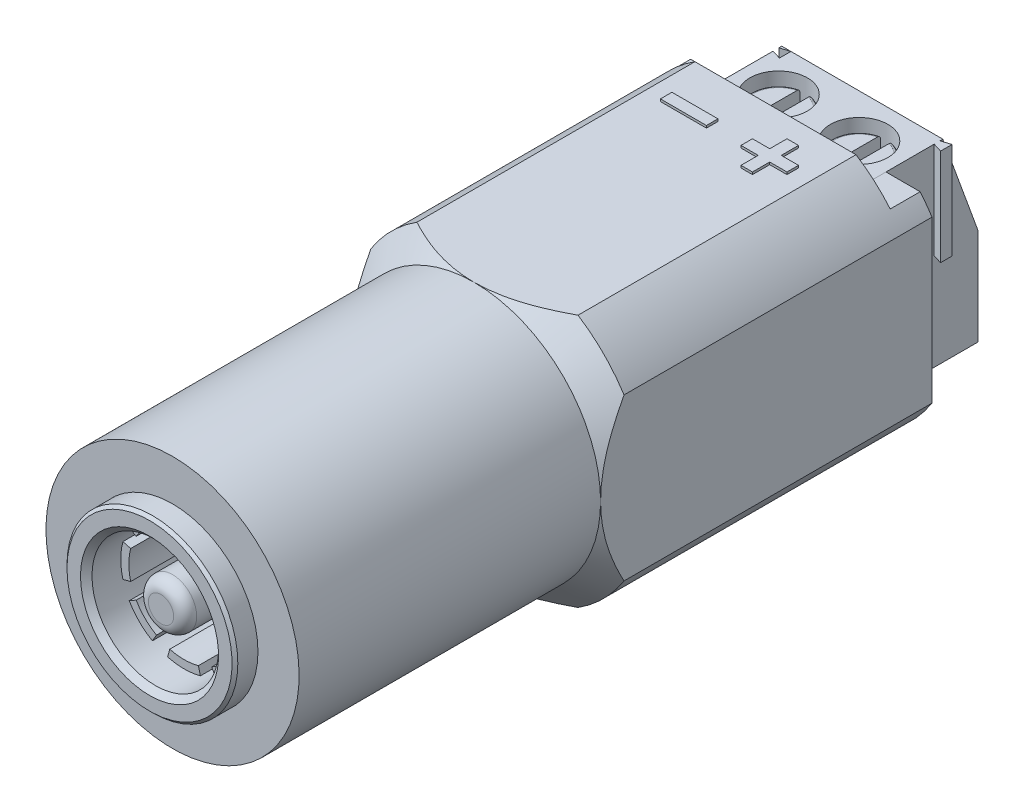
from build123d import *

# Parameters (mm, degrees)
BOSS_EXTRUDE3_DEPTH     = 13.1
SKETCH16_OUTSIDE_W      = 51.564
SKETCH16_OUTSIDE_H      = 51.564
SKETCH16_OUTSIDE_R      = 5.5
CUT_EXTRUDE2_DEPTH      = 16.235156711
CUT_EXTRUDE2_DRAFT      = -45
BOSS_EXTRUDE4_START     = 1.3
BOSS_EXTRUDE4_DEPTH     = 1.3
SKETCH17_W              = 7
SKETCH17_H              = 8.4
BOSS_EXTRUDE5_DEPTH     = 5.3
CUT_EXTRUDE3_DEPTH      = 19.015618285
CUT_EXTRUDE3_DEPTH_BACK = 19.015618285
BOSS_EXTRUDE6_DEPTH     = 4.2
CUT_EXTRUDE4_DEPTH      = 19.015618285
SKETCH22_W              = 2.375
SKETCH22_H              = 3.45
CUT_EXTRUDE5_DEPTH      = 5.3
CUT_EXTRUDE6_REACH      = 21.708
SKETCH23_R              = 1.25
SKETCH30_R              = 3.7125
CUT_EXTRUDE8_DEPTH      = 4
SKETCH6_W               = 5
SKETCH6_H               = 0.9625
CHAMFER5_SIZE           = 0.25
CHAMFER6_SIZE           = 0.125
SKETCH25_R              = 1.2
BOSS_EXTRUDE7_DEPTH     = 3.7
BOSS_EXTRUDE7_2_DEPTH   = 3.7
SKETCH26_W              = 0.5
SKETCH26_H              = 6.828674984
CUT_EXTRUDE7_DEPTH      = 1
FILLET12_R              = 0.125
FILLET13_R              = 0.125
BOSS_EXTRUDE8_DEPTH     = 5.3
BOSS_EXTRUDE8_2_DEPTH   = 5.3
SKETCH28_W              = 1
SKETCH28_H              = 0.488334262
BOSS_EXTRUDE9_DEPTH     = 2
BOSS_EXTRUDE9_2_DEPTH   = 2
FILLET14_R              = 0.2
FILLET15_R              = 0.2
SKETCH31_R              = 1.05
BOSS_EXTRUDE11_DEPTH    = 4.5
BOSS_EXTRUDE12_START    = -1
BOSS_EXTRUDE12_DEPTH    = 3.5
FILLET17_R              = 0.5
SKETCH29_W              = 2
SKETCH29_H              = 0.5
BOSS_EXTRUDE10_DEPTH    = 0.1


with BuildPart() as part:
    # Sketch2 → Revolve1 (revolve)
    with BuildSketch(Plane(origin=(0, 0, 0), x_dir=(0, 0, -1), z_dir=(1, 0, 0))):
        Polygon((-15.25, 5.5), (10.95, 5.5), (10.95, 0), (0, 0), (-15.25, 0), align=None)
    revolve(axis=Axis((0, 0, -10.95), (0, 0, 1)))

    # Sketch12 → Boss-Extrude3 (add)
    with BuildSketch(Plane(origin=(0, 0, -10.95), x_dir=(-1, 0, 0), z_dir=(0, 0, -1))):
        with BuildLine():
            Line((3.5, -5.5), (-3.5, -5.5))
            ThreePointArc((-3.5, -5.5), (-4.609772229, -4.609772229), (-5.5, -3.5))
            Line((-5.5, -3.5), (-5.5, 3.5))
            ThreePointArc((-5.5, 3.5), (-4.609772222, 4.609772222), (-3.5, 5.5))
            Line((-3.5, 5.5), (3.5, 5.5))
            ThreePointArc((3.5, 5.5), (4.609772229, 4.609772229), (5.5, 3.5))
            Line((5.5, 3.5), (5.5, -3.5))
            ThreePointArc((5.5, -3.5), (4.609772229, -4.609772229), (3.5, -5.5))
        make_face()
    extrude(amount=-BOSS_EXTRUDE3_DEPTH)


with BuildPart() as cut_extrude2_tool:
    # Sketch16 outside → Cut-Extrude2 (with draft: the straight prism first)
    with BuildSketch(Plane.XY.offset(2.15)):
        Rectangle(SKETCH16_OUTSIDE_W, SKETCH16_OUTSIDE_H)
        with Locations(Location((0, 0, 0), (0, 0, 90))):
            Circle(SKETCH16_OUTSIDE_R, mode=Mode.SUBTRACT)
    extrude(amount=-CUT_EXTRUDE2_DEPTH)
    # Cut-Extrude2: the draft: its side faces are tilted about the plane it starts from
    cut_extrude2_sides = [cut_extrude2_tool.faces().sort_by_distance(p)[0] for p in [
        (0, -25.782, -5.967578355),
        (25.782, 0, -5.967578355),
        (0, 25.782, -5.967578355),
        (-25.782, 0, -5.967578355),
        (0, -5.5, -5.967578355),
    ]]
    draft(cut_extrude2_sides, Plane.XY.offset(2.15), CUT_EXTRUDE2_DRAFT)


with BuildPart() as part_1:
    add(part.part)

    # Cut-Extrude2: cut by cut_extrude2_tool
    add(cut_extrude2_tool.part, mode=Mode.SUBTRACT)

    # Sketch15 → Boss-Extrude4 (add)
    with BuildSketch(Plane(origin=(0, 0, -10.95), x_dir=(-1, 0, 0), z_dir=(0, 0, -1)).offset(BOSS_EXTRUDE4_START)):
        with BuildLine():
            Line((4.985980334, 4.2), (3.5, 4.2))
            Line((3.5, 4.2), (3.5, -4.2))
            Line((3.5, -4.2), (-3.5, -4.2))
            Line((-3.5, -4.2), (-3.5, 4.2))
            Line((-3.5, 4.2), (-4.985980334, 4.2))
            ThreePointArc((-4.985980334, 4.2), (-5.254659445, 3.858568912), (-5.5, 3.5))
            Line((-5.5, 3.5), (-5.5, -3.5))
            ThreePointArc((-5.5, -3.5), (-4.609772229, -4.609772229), (-3.5, -5.5))
            Line((-3.5, -5.5), (3.5, -5.5))
            ThreePointArc((3.5, -5.5), (4.609772229, -4.609772229), (5.5, -3.5))
            Line((5.5, -3.5), (5.5, 3.5))
            ThreePointArc((5.5, 3.5), (5.254659449, 3.858568915), (4.985980334, 4.2))
        make_face()
    extrude(amount=-BOSS_EXTRUDE4_DEPTH)

    # Sketch30 → Cut-Extrude8 (cut)
    with BuildSketch(Plane.XY.offset(15.25)):
        Circle(SKETCH30_R)
    extrude(amount=-CUT_EXTRUDE8_DEPTH, mode=Mode.SUBTRACT)

    # Sketch29 → Boss-Extrude10 (add)
    with BuildSketch(Plane(origin=(0, 5.5, 0), x_dir=(1, 0, 0), z_dir=(0, 1, 0))):
        Polygon((2.75, 8.7), (2, 8.7), (2, 7.95), (1.5, 7.95), (1.5, 8.7), (0.75, 8.7), (0.75, 9.2), (1.5, 9.2), (1.5, 9.95), (2, 9.95), (2, 9.2), (2.75, 9.2), align=None)
        with Locations((-1.75, 8.95)):
            Rectangle(SKETCH29_W, SKETCH29_H)
    extrude(amount=BOSS_EXTRUDE10_DEPTH)


with BuildPart() as body_2:
    # Sketch17 → Boss-Extrude5 (new body)
    with BuildSketch(Plane(origin=(0, 0, -10.95), x_dir=(-1, 0, 0), z_dir=(0, 0, -1))):
        Rectangle(SKETCH17_W, SKETCH17_H)
    extrude(amount=BOSS_EXTRUDE5_DEPTH)

    # Sketch18 → Cut-Extrude3 (cut, two sides: drawn at the far end of the back side and taken through both)
    with BuildSketch(Plane(origin=(0, 0, 0), x_dir=(0, 0, -1), z_dir=(1, 0, 0)).offset(-CUT_EXTRUDE3_DEPTH_BACK)):
        Polygon((16.25, 0), (14.721325016, 4.2), (16.25, 4.2), align=None)
    extrude(amount=CUT_EXTRUDE3_DEPTH + CUT_EXTRUDE3_DEPTH_BACK, mode=Mode.SUBTRACT)

    # Sketch19 → Boss-Extrude6 (add)
    with BuildSketch(Plane(origin=(0, 4.2, 0), x_dir=(1, 0, 0), z_dir=(0, 1, 0))):
        Polygon((3.9, 14.221325016), (3.5, 14.346325016), (3.5, 14.471325016), (3.5, 14.596325016), (3.9, 14.721325016), align=None)
    extrude(amount=-BOSS_EXTRUDE6_DEPTH)

    # Sketch21 → Cut-Extrude4 (cut, through all)
    with BuildSketch(Plane.XZ):
        Polygon((-3.1, -14.221325016), (-3.5, -14.346325016), (-3.5, -14.596325016), (-3.1, -14.721325016), align=None)
    extrude(amount=-CUT_EXTRUDE4_DEPTH, mode=Mode.SUBTRACT)

    # Sketch22 → Cut-Extrude5 (cut)
    with BuildSketch(Plane(origin=(0, 0, -16.25), x_dir=(-1, 0, 0), z_dir=(0, 0, -1))):
        with Locations((-1.5625, -1.725)):
            Rectangle(SKETCH22_W, SKETCH22_H)
        with Locations((1.5625, -1.725)):
            Rectangle(SKETCH22_W, SKETCH22_H)
    extrude(amount=-CUT_EXTRUDE5_DEPTH, mode=Mode.SUBTRACT)

    # Cut-Extrude6: up to this face of the body (flat: up to its plane)
    cut_extrude6_end = Plane(body_2.part.faces().sort_by_distance((1.5625, -3.45, -13.6))[0])
    # Sketch23 → Cut-Extrude6 (cut, up to the picked face)
    with BuildSketch(Plane(origin=(0, 4.2, 0), x_dir=(1, 0, 0), z_dir=(0, 1, 0)), mode=Mode.PRIVATE) as cut_extrude6_sk1:
        with Locations(Location((-1.75, 12.835662508, 0), (0, 0, 270))):
            Circle(SKETCH23_R)
    cut_extrude6_tool1 = split(extrude(cut_extrude6_sk1.sketch, amount=-CUT_EXTRUDE6_REACH, mode=Mode.PRIVATE), bisect_by=cut_extrude6_end, keep=Keep.BOTH, mode=Mode.PRIVATE)
    # Sketch23 → Cut-Extrude6 (cut, up to the picked face)
    with BuildSketch(Plane(origin=(0, 4.2, 0), x_dir=(1, 0, 0), z_dir=(0, 1, 0)), mode=Mode.PRIVATE) as cut_extrude6_sk2:
        with Locations(Location((1.75, 12.835662508, 0), (0, 0, 270))):
            Circle(SKETCH23_R)
    cut_extrude6_tool2 = split(extrude(cut_extrude6_sk2.sketch, amount=-CUT_EXTRUDE6_REACH, mode=Mode.PRIVATE), bisect_by=cut_extrude6_end, keep=Keep.BOTH, mode=Mode.PRIVATE)
    add(cut_extrude6_tool1.solids().sort_by(Axis((-1.75, 4.2, -12.835663), (0, -1, 0)))[0], mode=Mode.SUBTRACT)
    add(cut_extrude6_tool2.solids().sort_by(Axis((1.75, 4.2, -12.835663), (0, -1, 0)))[0], mode=Mode.SUBTRACT)


with BuildPart() as body_3:
    # Sketch6 → Revolve4 (revolve)
    with BuildSketch(Plane(origin=(0, 0, 0), x_dir=(0, 0, -1), z_dir=(1, 0, 0)), mode=Mode.PRIVATE) as revolve4_sk:
        with Locations((-13.75, 3.23125)):
            Rectangle(SKETCH6_W, SKETCH6_H)
    revolve(revolve4_sk.sketch.rotate(Axis((0, 0, 16.25), (0, 0, -1)), 90), axis=Axis((0, 0, 16.25), (0, 0, -1)))

    # Chamfer5
    chamfer5_edges = [body_3.edges().sort_by_distance(p)[0] for p in [
        (-2.75, 0, 16.25),
    ]]
    chamfer(chamfer5_edges, length=CHAMFER5_SIZE)

    # Chamfer6
    chamfer6_edges = [body_3.edges().sort_by_distance(p)[0] for p in [
        (-3.7125, 0, 16.25),
    ]]
    chamfer(chamfer6_edges, length=CHAMFER6_SIZE)

    # Sketch32 → Boss-Extrude12 (add)
    with BuildSketch(Plane.XY.offset(15.75).offset(BOSS_EXTRUDE12_START)):
        with BuildLine():
            Line((-0.621165708, 2.318221983), (-0.711752374, 2.656296022))
            ThreePointArc((-0.711752374, 2.656296022), (0, 2.75), (0.711752374, 2.656296022))
            Line((0.711752374, 2.656296022), (0.621165708, 2.318221983))
            ThreePointArc((0.621165708, 2.318221983), (0, 2.4), (-0.621165708, 2.318221983))
        make_face()
        with BuildLine():
            Line((2.078460969, 1.2), (2.38156986, 1.375))
            ThreePointArc((2.38156986, 1.375), (1.944543648, 1.944543648), (1.375, 2.38156986))
            Line((1.375, 2.38156986), (1.2, 2.078460969))
            ThreePointArc((1.2, 2.078460969), (1.697056275, 1.697056275), (2.078460969, 1.2))
        make_face()
        with BuildLine():
            Line((2.318221983, -0.621165708), (2.656296022, -0.711752374))
            ThreePointArc((2.656296022, -0.711752374), (2.75, 0), (2.656296022, 0.711752374))
            Line((2.656296022, 0.711752374), (2.318221983, 0.621165708))
            ThreePointArc((2.318221983, 0.621165708), (2.4, 0), (2.318221983, -0.621165708))
        make_face()
        with BuildLine():
            Line((1.2, -2.078460969), (1.375, -2.38156986))
            ThreePointArc((1.375, -2.38156986), (1.944543648, -1.944543648), (2.38156986, -1.375))
            Line((2.38156986, -1.375), (2.078460969, -1.2))
            ThreePointArc((2.078460969, -1.2), (1.697056275, -1.697056275), (1.2, -2.078460969))
        make_face()
        with BuildLine():
            Line((-0.621165708, -2.318221983), (-0.711752374, -2.656296022))
            ThreePointArc((-0.711752374, -2.656296022), (0, -2.75), (0.711752374, -2.656296022))
            Line((0.711752374, -2.656296022), (0.621165708, -2.318221983))
            ThreePointArc((0.621165708, -2.318221983), (0, -2.4), (-0.621165708, -2.318221983))
        make_face()
        with BuildLine():
            Line((-2.078460969, -1.2), (-2.38156986, -1.375))
            ThreePointArc((-2.38156986, -1.375), (-1.944543648, -1.944543648), (-1.375, -2.38156986))
            Line((-1.375, -2.38156986), (-1.2, -2.078460969))
            ThreePointArc((-1.2, -2.078460969), (-1.697056275, -1.697056275), (-2.078460969, -1.2))
        make_face()
        with BuildLine():
            Line((-2.318221983, 0.621165708), (-2.656296022, 0.711752374))
            ThreePointArc((-2.656296022, 0.711752374), (-2.75, 0), (-2.656296022, -0.711752374))
            Line((-2.656296022, -0.711752374), (-2.318221983, -0.621165708))
            ThreePointArc((-2.318221983, -0.621165708), (-2.4, 0), (-2.318221983, 0.621165708))
        make_face()
        with BuildLine():
            Line((-1.2, 2.078460969), (-1.375, 2.38156986))
            ThreePointArc((-1.375, 2.38156986), (-1.944543648, 1.944543648), (-2.38156986, 1.375))
            Line((-2.38156986, 1.375), (-2.078460969, 1.2))
            ThreePointArc((-2.078460969, 1.2), (-1.697056275, 1.697056275), (-1.2, 2.078460969))
        make_face()
    extrude(amount=-BOSS_EXTRUDE12_DEPTH)


with BuildPart() as body_4:
    # Sketch25 → Boss-Extrude7 (new body)
    with BuildSketch(Plane.XZ):
        with Locations(Location((1.75, -12.835662508, 0), (0, 0, 270))):
            Circle(SKETCH25_R)
    extrude(amount=-BOSS_EXTRUDE7_DEPTH)


with BuildPart() as body_5:
    # Sketch25 → Boss-Extrude7 2 (new body)
    with BuildSketch(Plane.XZ):
        with Locations(Location((-1.75, -12.835662508, 0), (0, 0, 270))):
            Circle(SKETCH25_R)
    extrude(amount=-BOSS_EXTRUDE7_2_DEPTH)


with BuildPart() as cut_extrude7_tool:
    # Sketch26 → Cut-Extrude7 (new body)
    with BuildSketch(Plane(origin=(0, 3.7, 0), x_dir=(1, 0, 0), z_dir=(0, 1, 0))):
        with Locations((1.75, 12.835662508)):
            Rectangle(SKETCH26_W, SKETCH26_H)
        with Locations((-1.75, 12.835662508)):
            Rectangle(SKETCH26_W, SKETCH26_H)
    extrude(amount=-CUT_EXTRUDE7_DEPTH)


with BuildPart() as body_5_1:
    add(body_5.part)

    # Cut-Extrude7: cut by cut_extrude7_tool
    add(cut_extrude7_tool.part, mode=Mode.SUBTRACT)

    # Fillet12
    fillet12_edges = [body_5_1.edges().sort_by_distance(p)[0] for p in [
        (-0.55, 3.7, -12.835662508),
        (-2.95, 3.7, -12.835662508),
    ]]
    fillet(fillet12_edges, radius=FILLET12_R)


with BuildPart() as body_4_1:
    add(body_4.part)

    # Cut-Extrude7: cut by cut_extrude7_tool
    add(cut_extrude7_tool.part, mode=Mode.SUBTRACT)

    # Fillet13
    fillet13_edges = [body_4_1.edges().sort_by_distance(p)[0] for p in [
        (2.95, 3.7, -12.835662508),
        (0.55, 3.7, -12.835662508),
    ]]
    fillet(fillet13_edges, radius=FILLET13_R)


with BuildPart() as body_6:
    # Sketch27 → Boss-Extrude8 (new body)
    with BuildSketch(Plane(origin=(0, 0, -10.95), x_dir=(-1, 0, 0), z_dir=(0, 0, -1))):
        with BuildLine():
            Line((-2.45, -3.25), (-0.675, -3.25))
            ThreePointArc((-0.675, -3.25), (-0.533578644, -3.191421356), (-0.475, -3.05))
            Line((-0.475, -3.05), (-0.475, -0.125))
            Line((-0.475, -0.125), (-1.0625, -0.125))
            Line((-1.0625, -0.125), (-1.0625, -1.101668523))
            ThreePointArc((-1.0625, -1.101668523), (-1.5625, -2.75), (-2.0625, -1.101668523))
            Line((-2.0625, -1.101668523), (-2.0625, -0.125))
            Line((-2.0625, -0.125), (-2.65, -0.125))
            Line((-2.65, -0.125), (-2.65, -3.05))
            ThreePointArc((-2.65, -3.05), (-2.591421356, -3.191421356), (-2.45, -3.25))
        make_face()
    extrude(amount=BOSS_EXTRUDE8_DEPTH)


with BuildPart() as body_7:
    # Sketch27 → Boss-Extrude8 2 (new body)
    with BuildSketch(Plane(origin=(0, 0, -10.95), x_dir=(-1, 0, 0), z_dir=(0, 0, -1))):
        with BuildLine():
            Line((1.0625, -0.125), (1.0625, -1.101668523))
            ThreePointArc((1.0625, -1.101668523), (1.5625, -2.75), (2.0625, -1.101668523))
            Line((2.0625, -1.101668523), (2.0625, -0.125))
            Line((2.0625, -0.125), (2.65, -0.125))
            Line((2.65, -0.125), (2.65, -3.05))
            ThreePointArc((2.65, -3.05), (2.591421356, -3.191421356), (2.45, -3.25))
            Line((2.45, -3.25), (0.675, -3.25))
            ThreePointArc((0.675, -3.25), (0.533578644, -3.191421356), (0.475, -3.05))
            Line((0.475, -3.05), (0.475, -0.125))
            Line((0.475, -0.125), (1.0625, -0.125))
        make_face()
    extrude(amount=BOSS_EXTRUDE8_2_DEPTH)


with BuildPart() as body_8:
    # Sketch28 → Boss-Extrude9 (new body)
    with BuildSketch(Plane(origin=(0, 0, -16.25), x_dir=(-1, 0, 0), z_dir=(0, 0, -1))):
        with Locations((-1.5625, -0.857501392)):
            Rectangle(SKETCH28_W, SKETCH28_H)
    extrude(amount=-BOSS_EXTRUDE9_DEPTH)

    # Fillet14
    fillet14_edges = [body_8.edges().sort_by_distance(p)[0] for p in [
        (1.5625, -0.613334261, -16.25),
        (1.5625, -1.101668523, -16.25),
    ]]
    fillet(fillet14_edges, radius=FILLET14_R)


with BuildPart() as body_9:
    # Sketch28 → Boss-Extrude9 2 (new body)
    with BuildSketch(Plane(origin=(0, 0, -16.25), x_dir=(-1, 0, 0), z_dir=(0, 0, -1))):
        with Locations((1.5625, -0.857501392)):
            Rectangle(SKETCH28_W, SKETCH28_H)
    extrude(amount=-BOSS_EXTRUDE9_2_DEPTH)

    # Fillet15
    fillet15_edges = [body_9.edges().sort_by_distance(p)[0] for p in [
        (-1.5625, -0.613334261, -16.25),
        (-1.5625, -1.101668523, -16.25),
    ]]
    fillet(fillet15_edges, radius=FILLET15_R)


with BuildPart() as body_10:
    # Sketch31 → Boss-Extrude11 (new body)
    with BuildSketch(Plane.XY.offset(11.25)):
        with Locations(Location((0, 0, 0), (0, 0, 180))):
            Circle(SKETCH31_R)
    extrude(amount=BOSS_EXTRUDE11_DEPTH)

    # Fillet17
    fillet17_edges = [body_10.edges().sort_by_distance(p)[0] for p in [
        (1.05, 0, 15.75),
    ]]
    fillet(fillet17_edges, radius=FILLET17_R)


solid = Compound([part_1.part, body_2.part, body_3.part, body_5_1.part, body_4_1.part, body_6.part, body_7.part, body_8.part, body_9.part, body_10.part])
